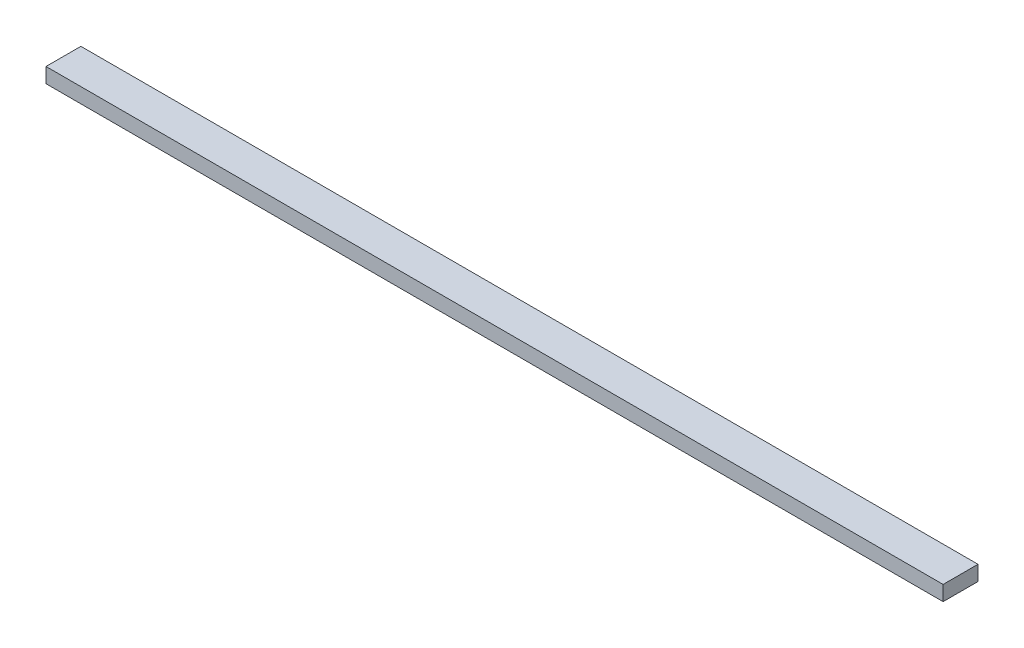
from build123d import *

# Parameters (mm, degrees)
SKETCH2_W           = 88.9
SKETCH2_H           = 38.1
BOSS_EXTRUDE1_DEPTH = 2286


with BuildPart() as part:
    # Sketch2 → Boss-Extrude1 (new body)
    with BuildSketch(Plane(origin=(0, 0, 0), x_dir=(0, 0, -1), z_dir=(1, 0, 0))):
        Rectangle(SKETCH2_W, SKETCH2_H)
    extrude(amount=BOSS_EXTRUDE1_DEPTH)


solid = part.part
